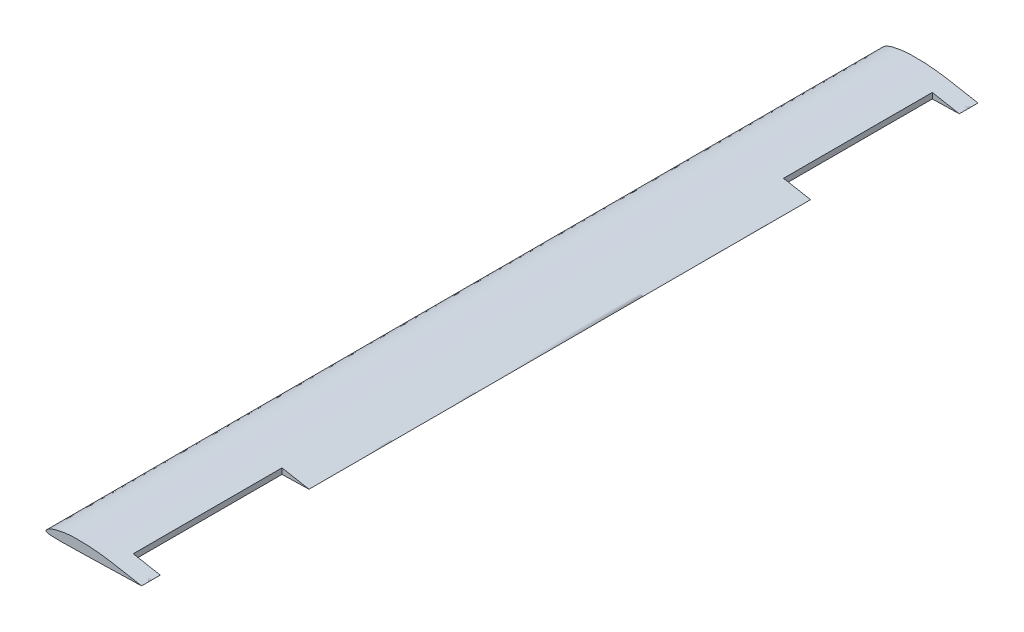
from build123d import *

# Parameters (mm, degrees)
BOSS_EXTRUDE1_DEPTH = 875
SKETCH2_W           = 80.760580462
SKETCH2_H           = 108.55553294
BOSS_EXTRUDE2_DEPTH = 10
SKETCH3_W           = 74.562270492
SKETCH3_H           = 43.476270514
BOSS_EXTRUDE3_DEPTH = 10
SKETCH4_W           = 56.548116249
SKETCH4_H           = 311.192527761
CUT_EXTRUDE1_DEPTH  = 888.936475467


with BuildPart() as part:
    # Sketch1 → Boss-Extrude1 (new, symmetric)
    with BuildSketch(Plane.XY):
        with BuildLine():
            add(Edge.make_bspline(
                [(150, 0), (149.999685432, 0.011137501), (149.185629686, 0.079599271), (148.362349609, 0.23854718), (146.383595891, 0.535828379), (143.975549334, 0.962808352), (140.845175163, 1.509100839), (137.157536262, 2.176029136), (132.907625451, 2.969281671), (128.156422521, 3.873961727), (122.950049785, 4.887860135), (117.339343888, 5.98461827), (111.379456374, 7.15084592), (105.122384646, 8.362662885), (98.604061548, 9.566419981), (91.857920469, 10.727303622), (84.924222345, 11.862484255), (77.836652116, 12.928359051), (70.638845299, 13.915157923), (63.371696052, 14.820144), (56.068248712, 15.599623663), (48.769465666, 16.270561295), (41.508506197, 16.804574125), (34.324968703, 17.187593756), (27.252542914, 17.43744655), (20.325402615, 17.524130752), (13.578234797, 17.453738953), (7.041829916, 17.231221238), (0.744139078, 16.842790145), (-5.28706646, 16.302437679), (-11.026056632, 15.619187543), (-16.442874069, 14.785962894), (-21.518953841, 13.836701958), (-26.230367257, 12.76343092), (-30.557255547, 11.585522165), (-34.484037063, 10.323714507), (-37.992816268, 8.989600554), (-41.073498091, 7.611551682), (-43.71302097, 6.207732839), (-45.901320793, 4.798740069), (-47.631161772, 3.43292398), (-48.918728294, 2.122328801), (-49.680148605, 0.959925724), (-50.148351933, -0.155072165), (-49.524268162, -1.166960599), (-48.362619911, -1.842209025), (-46.664951951, -2.485494088), (-44.363101536, -2.94989849), (-41.451092055, -3.278688246), (-37.931028928, -3.546816469), (-33.824873936, -3.768109302), (-29.158463644, -3.887986788), (-23.965830731, -3.996914377), (-18.282701864, -4.023703652), (-12.151188536, -4.032477259), (-5.613822936, -3.96084977), (1.293896963, -3.870928981), (8.534096681, -3.696783666), (16.066850289, -3.521047337), (23.840215919, -3.321283964), (31.79996501, -3.098849108), (39.887632236, -2.872363015), (48.047003627, -2.686479416), (56.216688855, -2.460792702), (64.343672436, -2.234090406), (72.373777077, -2.050144318), (80.253746259, -1.817291305), (87.935095991, -1.617201779), (95.364484114, -1.451918417), (102.478479779, -1.239703786), (109.216521507, -1.061304167), (115.543555003, -0.907638554), (121.451776676, -0.740946355), (126.933447967, -0.601572319), (131.952049659, -0.486330374), (136.45473162, -0.371062991), (140.368394028, -0.240535843), (143.692337232, -0.16069725), (146.24026167, -0.117578972), (148.313210121, -0.035134836), (149.167754934, -0.030878354), (150.000317632, -0.011245986), (150, 0)],
                knots=[0, 0, 0, 0, 0.000950607, 0.003756507, 0.008317118, 0.014521534, 0.022293258, 0.031559824, 0.042220752, 0.054150955, 0.067231026, 0.081331038, 0.096307423, 0.112011952, 0.128327294, 0.145184499, 0.162487629, 0.180135525, 0.198033488, 0.216058829, 0.234134495, 0.252191782, 0.270104077, 0.287817033, 0.305234681, 0.322284448, 0.338896329, 0.354986109, 0.370505848, 0.385416956, 0.399632136, 0.413115968, 0.42582253, 0.437703697, 0.448737409, 0.458879724, 0.468105333, 0.476404612, 0.483748471, 0.49013386, 0.495557186, 0.500011534, 0.503516098, 0.506001286, 0.508215361, 0.511493607, 0.515843652, 0.521547383, 0.528754592, 0.537448665, 0.547575188, 0.55907379, 0.571867409, 0.585873248, 0.600979911, 0.617080267, 0.634081341, 0.651920682, 0.670483603, 0.689642387, 0.709259499, 0.729200941, 0.749303287, 0.769441295, 0.789466278, 0.8092541, 0.828669736, 0.847597548, 0.865914743, 0.883466594, 0.900078509, 0.915617835, 0.930134998, 0.943663107, 0.956049855, 0.967158865, 0.976852657, 0.984995817, 0.991471781, 0.996183553, 0.999040133, 1, 1, 1, 1], degree=3))
        make_face()
    extrude(amount=BOSS_EXTRUDE1_DEPTH, both=True)

    # Sketch2 → Boss-Extrude2 (add)
    with BuildSketch(Plane(origin=(0, 0, 0), x_dir=(1, 0, 0), z_dir=(0, 1, 0))):
        Rectangle(SKETCH2_W, SKETCH2_H)
    extrude(amount=-BOSS_EXTRUDE2_DEPTH)

    # Sketch3 → Boss-Extrude3 (add)
    with BuildSketch(Plane(origin=(0, 0, 0), x_dir=(1, 0, 0), z_dir=(0, 1, 0))):
        with Locations((0, 400)):
            Rectangle(SKETCH3_W, SKETCH3_H)
    boss_extrude3 = extrude(amount=-BOSS_EXTRUDE3_DEPTH)

    # Mirror1: Boss-Extrude3 across plane
    add(boss_extrude3.mirror(Plane.XY))

    # Sketch4 → Cut-Extrude1 (cut, symmetric)
    with BuildSketch(Plane(origin=(0, 0, 0), x_dir=(1, 0, 0), z_dir=(0, 1, 0))):
        with Locations((121.725942237, 680.281339757)):
            Rectangle(SKETCH4_W, SKETCH4_H)
    cut_extrude1 = extrude(amount=CUT_EXTRUDE1_DEPTH, both=True, mode=Mode.SUBTRACT)

    # Mirror2: Cut-Extrude1 across plane
    add(cut_extrude1.mirror(Plane.XY), mode=Mode.SUBTRACT)


solid = part.part
